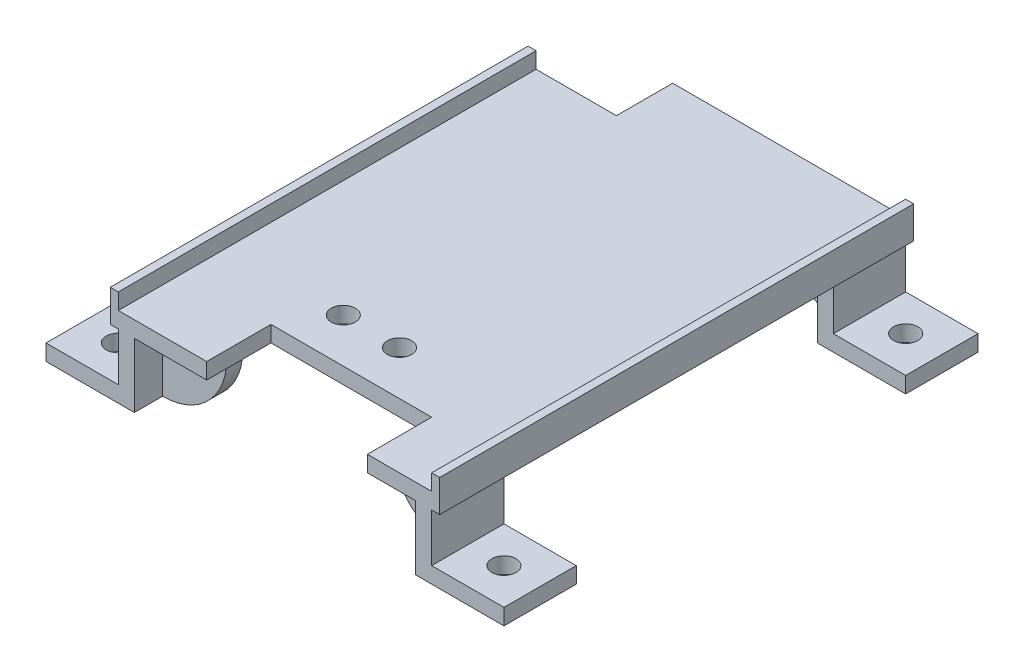
from build123d import *

# Parameters (mm, degrees)
SKETCH1_W           = 57
SKETCH1_H           = 59
BOSS_EXTRUDE1_DEPTH = 10
SKETCH2_W           = 41
SKETCH2_H           = 10
CUT_EXTRUDE1_DEPTH  = 9
SKETCH4_W           = 10
SKETCH4_H           = 7
CUT_EXTRUDE3_DEPTH  = 83.643814046
SKETCH5_W           = 34
SKETCH5_H           = 10
CUT_EXTRUDE4_DEPTH  = 9
SKETCH8_W           = 20
SKETCH8_H           = 10
CUT_EXTRUDE5_DEPTH  = 8
SKETCH9_W           = 35
SKETCH9_H           = 59
CUT_EXTRUDE6_DEPTH  = 8
SKETCH10_W          = 9
SKETCH10_H          = 7
CUT_EXTRUDE7_DEPTH  = 83.643814046
SKETCH11_W          = 9
SKETCH11_H          = 9
CUT_EXTRUDE8_DEPTH  = 8
SKETCH12_W          = 9
SKETCH12_H          = 9
CUT_EXTRUDE9_DEPTH  = 8
SKETCH13_W          = 9
SKETCH13_H          = 9
CUT_EXTRUDE10_DEPTH = 8
SKETCH14_W          = 9
SKETCH14_H          = 9
CUT_EXTRUDE11_DEPTH = 8
SKETCH15_W          = 2
SKETCH15_H          = 41
CUT_EXTRUDE12_DEPTH = 8
SKETCH16_W          = 2
SKETCH16_H          = 34
CUT_EXTRUDE13_DEPTH = 8
SKETCH31_W          = 2
SKETCH31_H          = 8
REVOLVE3_ANGLE      = 90
SKETCH32_W          = 2
SKETCH32_H          = 8
REVOLVE4_ANGLE      = 90
SKETCH33_W          = 6
SKETCH33_H          = 2
REVOLVE5_ANGLE      = 90
SKETCH34_W          = 2
SKETCH34_H          = 8
REVOLVE6_ANGLE      = 90
SKETCH41_R          = 1.5
CUT_EXTRUDE14_DEPTH = 83.42572414
SKETCH42_R          = 1.5
CUT_EXTRUDE15_DEPTH = 83.643814046
SKETCH46_W          = 59
SKETCH46_H          = 2
BOSS_EXTRUDE3_DEPTH = 1
SKETCH47_W          = 1
SKETCH47_H          = 59
BOSS_EXTRUDE4_DEPTH = 2
SKETCH48_W          = 52
SKETCH48_H          = 2
BOSS_EXTRUDE5_DEPTH = 1
SKETCH49_W          = 1
SKETCH49_H          = 52
BOSS_EXTRUDE6_DEPTH = 2


with BuildPart() as part:
    # Sketch1 → Boss-Extrude1 (new body)
    with BuildSketch(Plane(origin=(0, 0, 0), x_dir=(1, 0, 0), z_dir=(0, 1, 0))):
        with Locations((28.5, 29.5)):
            Rectangle(SKETCH1_W, SKETCH1_H)
    extrude(amount=BOSS_EXTRUDE1_DEPTH)

    # Sketch2 → Cut-Extrude1 (cut)
    with BuildSketch(Plane(origin=(57, 0, 0), x_dir=(0, 0, -1), z_dir=(1, 0, 0))):
        with Locations((29.5, 5)):
            Rectangle(SKETCH2_W, SKETCH2_H)
    extrude(amount=-CUT_EXTRUDE1_DEPTH, mode=Mode.SUBTRACT)

    # Sketch4 → Cut-Extrude3 (cut, through all)
    with BuildSketch(Plane(origin=(0, 10, 0), x_dir=(1, 0, 0), z_dir=(0, 1, 0))):
        with Locations((5, 55.5)):
            Rectangle(SKETCH4_W, SKETCH4_H)
    extrude(amount=-CUT_EXTRUDE3_DEPTH, mode=Mode.SUBTRACT)

    # Sketch5 → Cut-Extrude4 (cut)
    with BuildSketch(Plane.ZY):
        with Locations((-26, 5)):
            Rectangle(SKETCH5_W, SKETCH5_H)
    extrude(amount=-CUT_EXTRUDE4_DEPTH, mode=Mode.SUBTRACT)

    # Sketch8 → Cut-Extrude5 (cut)
    with BuildSketch(Plane.XY):
        with Locations((30, 5)):
            Rectangle(SKETCH8_W, SKETCH8_H)
    extrude(amount=-CUT_EXTRUDE5_DEPTH, mode=Mode.SUBTRACT)

    # Sketch9 → Cut-Extrude6 (cut)
    with BuildSketch(Plane(origin=(0, 0, 0), x_dir=(-1, 0, 0), z_dir=(0, -1, 0))):
        with Locations((-28.5, 29.5)):
            Rectangle(SKETCH9_W, SKETCH9_H)
    extrude(amount=-CUT_EXTRUDE6_DEPTH, mode=Mode.SUBTRACT)

    # Sketch10 → Cut-Extrude7 (cut, through all)
    with BuildSketch(Plane(origin=(0, 10, 0), x_dir=(1, 0, 0), z_dir=(0, 1, 0))):
        with Locations((14.5, 55.5)):
            Rectangle(SKETCH10_W, SKETCH10_H)
    extrude(amount=-CUT_EXTRUDE7_DEPTH, mode=Mode.SUBTRACT)

    # Sketch11 → Cut-Extrude8 (cut)
    with BuildSketch(Plane(origin=(0, 10, 0), x_dir=(1, 0, 0), z_dir=(0, 1, 0))):
        with Locations((52.5, 4.5)):
            Rectangle(SKETCH11_W, SKETCH11_H)
    extrude(amount=-CUT_EXTRUDE8_DEPTH, mode=Mode.SUBTRACT)

    # Sketch12 → Cut-Extrude9 (cut)
    with BuildSketch(Plane(origin=(0, 10, 0), x_dir=(1, 0, 0), z_dir=(0, 1, 0))):
        with Locations((52.5, 54.5)):
            Rectangle(SKETCH12_W, SKETCH12_H)
    extrude(amount=-CUT_EXTRUDE9_DEPTH, mode=Mode.SUBTRACT)

    # Sketch13 → Cut-Extrude10 (cut)
    with BuildSketch(Plane(origin=(0, 10, 0), x_dir=(1, 0, 0), z_dir=(0, 1, 0))):
        with Locations((4.5, 47.5)):
            Rectangle(SKETCH13_W, SKETCH13_H)
    extrude(amount=-CUT_EXTRUDE10_DEPTH, mode=Mode.SUBTRACT)

    # Sketch14 → Cut-Extrude11 (cut)
    with BuildSketch(Plane(origin=(0, 10, 0), x_dir=(1, 0, 0), z_dir=(0, 1, 0))):
        with Locations((4.5, 4.5)):
            Rectangle(SKETCH14_W, SKETCH14_H)
    extrude(amount=-CUT_EXTRUDE11_DEPTH, mode=Mode.SUBTRACT)

    # Sketch15 → Cut-Extrude12 (cut)
    with BuildSketch(Plane(origin=(0, 0, 0), x_dir=(-1, 0, 0), z_dir=(0, -1, 0))):
        with Locations((-47, 29.5)):
            Rectangle(SKETCH15_W, SKETCH15_H)
    extrude(amount=-CUT_EXTRUDE12_DEPTH, mode=Mode.SUBTRACT)

    # Sketch16 → Cut-Extrude13 (cut)
    with BuildSketch(Plane(origin=(0, 0, 0), x_dir=(-1, 0, 0), z_dir=(0, -1, 0))):
        with Locations((-10, 26)):
            Rectangle(SKETCH16_W, SKETCH16_H)
    extrude(amount=-CUT_EXTRUDE13_DEPTH, mode=Mode.SUBTRACT)

    # Sketch31 → Revolve3 (revolve)
    with BuildSketch(Plane(origin=(11, 0, 0), x_dir=(0, 0, -1), z_dir=(1, 0, 0))):
        with Locations((4.5, 4)):
            Rectangle(SKETCH31_W, SKETCH31_H)
    revolve(axis=Axis((11, 8, -3.5), (0, 0, 1)), revolution_arc=REVOLVE3_ANGLE)

    # Sketch32 → Revolve4 (revolve)
    with BuildSketch(Plane(origin=(11, 0, 0), x_dir=(0, 0, -1), z_dir=(1, 0, 0))):
        with Locations((47.5, 4)):
            Rectangle(SKETCH32_W, SKETCH32_H)
    revolve(axis=Axis((11, 8, -46.5), (0, 0, 1)), revolution_arc=REVOLVE4_ANGLE)

    # Sketch33 → Revolve5 (revolve)
    with BuildSketch(Plane.XZ.offset(-8)):
        with Locations((43, -4.5)):
            Rectangle(SKETCH33_W, SKETCH33_H)
    revolve(axis=Axis((46, 8, -3.5), (0, 0, 1)), revolution_arc=REVOLVE5_ANGLE)

    # Sketch34 → Revolve6 (revolve)
    with BuildSketch(Plane.ZY.offset(-46)):
        with Locations((-54.5, 4)):
            Rectangle(SKETCH34_W, SKETCH34_H)
    revolve(axis=Axis((46, 8, -53.5), (0, 0, -1)), revolution_arc=REVOLVE6_ANGLE)

    # Sketch41 → Cut-Extrude14 (cut, through all)
    with BuildSketch(Plane(origin=(0, 2, 0), x_dir=(1, 0, 0), z_dir=(0, 1, 0))):
        with Locations(Location((52.5, 4.5, 0), (0, 0, 270))):
            Circle(SKETCH41_R)
        with Locations(Location((52.5, 54.5, 0), (0, 0, 270))):
            Circle(SKETCH41_R)
        with Locations(Location((4.5, 4.5, 0), (0, 0, 270))):
            Circle(SKETCH41_R)
        with Locations(Location((4.5, 47.5, 0), (0, 0, 270))):
            Circle(SKETCH41_R)
    extrude(amount=-CUT_EXTRUDE14_DEPTH, mode=Mode.SUBTRACT)

    # Sketch42 → Cut-Extrude15 (cut, through all)
    with BuildSketch(Plane(origin=(0, 10, 0), x_dir=(1, 0, 0), z_dir=(0, 1, 0))):
        with Locations(Location((23.5, 13.5, 0), (0, 0, 270))):
            Circle(SKETCH42_R)
        with Locations(Location((30.5, 13.5, 0), (0, 0, 270))):
            Circle(SKETCH42_R)
    extrude(amount=-CUT_EXTRUDE15_DEPTH, mode=Mode.SUBTRACT)

    # Sketch46 → Boss-Extrude3 (add)
    with BuildSketch(Plane(origin=(48, 0, 0), x_dir=(0, 0, -1), z_dir=(1, 0, 0))):
        with Locations((29.5, 9)):
            Rectangle(SKETCH46_W, SKETCH46_H)
    extrude(amount=BOSS_EXTRUDE3_DEPTH)

    # Sketch47 → Boss-Extrude4 (add)
    with BuildSketch(Plane(origin=(0, 10, 0), x_dir=(1, 0, 0), z_dir=(0, 1, 0))):
        with Locations((48.5, 29.5)):
            Rectangle(SKETCH47_W, SKETCH47_H)
    extrude(amount=BOSS_EXTRUDE4_DEPTH)

    # Sketch48 → Boss-Extrude5 (add)
    with BuildSketch(Plane.ZY.offset(-9)):
        with Locations((-26, 9)):
            Rectangle(SKETCH48_W, SKETCH48_H)
    extrude(amount=BOSS_EXTRUDE5_DEPTH)

    # Sketch49 → Boss-Extrude6 (add)
    with BuildSketch(Plane(origin=(0, 10, 0), x_dir=(1, 0, 0), z_dir=(0, 1, 0))):
        with Locations((8.5, 26)):
            Rectangle(SKETCH49_W, SKETCH49_H)
    extrude(amount=BOSS_EXTRUDE6_DEPTH)


solid = part.part
